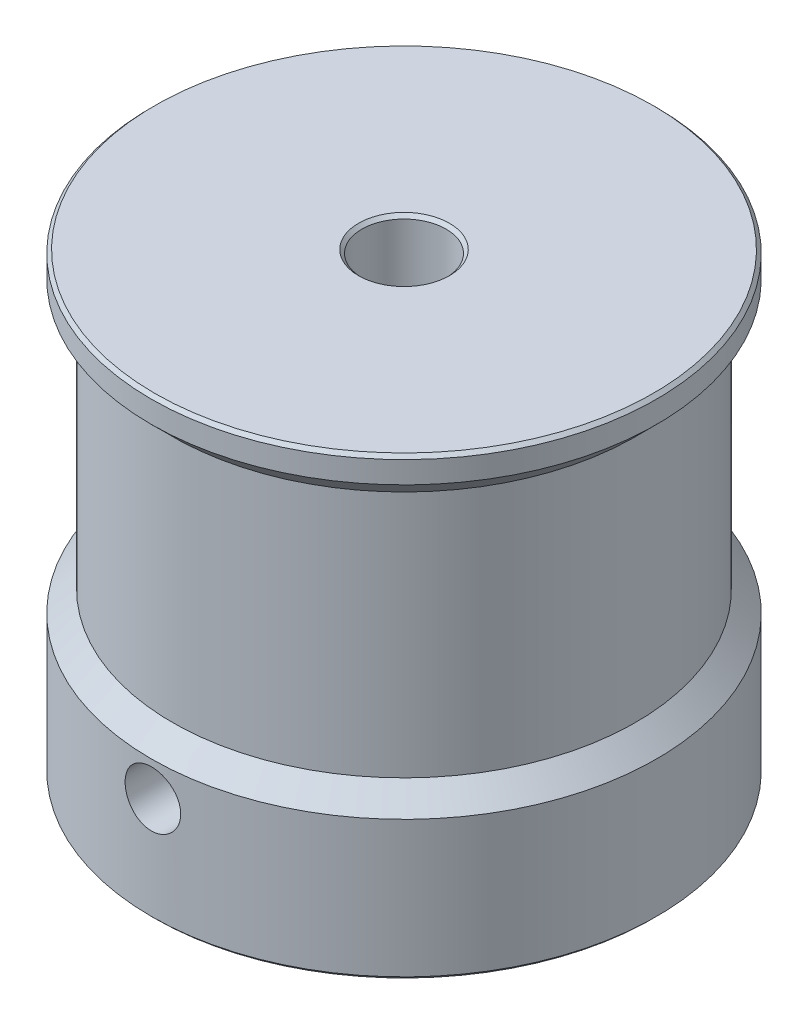
from build123d import *

# Parameters (mm, degrees)
SKETCH_21_W    = 1.65
SKETCH_21_H    = 15
CHAMFER_1_SIZE = 0.2


with BuildPart() as part:
    # Эскиз1 → Revolve 921 (revolve)
    with BuildSketch(Plane.XY, mode=Mode.PRIVATE) as revolve_921_sk:
        Polygon((13.75, 9.55), (13.75, 24.25), (15, 25.5), (15, 27), (2.5, 27), (2.5, 2.5), (11.5, 2.5), (11.5, 0), (15, 0), (15, 8.3), align=None)
    revolve(revolve_921_sk.sketch.rotate(Axis((0, 0, 0), (0, 1, 0)), 90), axis=Axis((0, 0, 0), (0, 1, 0)))

    # Эскиз21 → Фиксатор-M4 (revolve, cut)
    with BuildSketch(Plane(origin=(0, 6.25, 0), x_dir=(0, 1, 0), z_dir=(1, 0, 0))):
        with Locations((0.825, 7.5)):
            Rectangle(SKETCH_21_W, SKETCH_21_H)
    revolve(axis=Axis((0, 6.25, -6.35), (0, 0, 1)), mode=Mode.SUBTRACT)

    # Фаска1
    chamfer_1_edges = [part.edges().sort_by_distance(p)[0] for p in [
        (0, 0, 15),
        (0, 0, 11.5),
        (0, 2.5, 2.5),
        (0, 27, 2.5),
        (0, 27, 15),
    ]]
    chamfer(chamfer_1_edges, length=CHAMFER_1_SIZE)


solid = part.part
